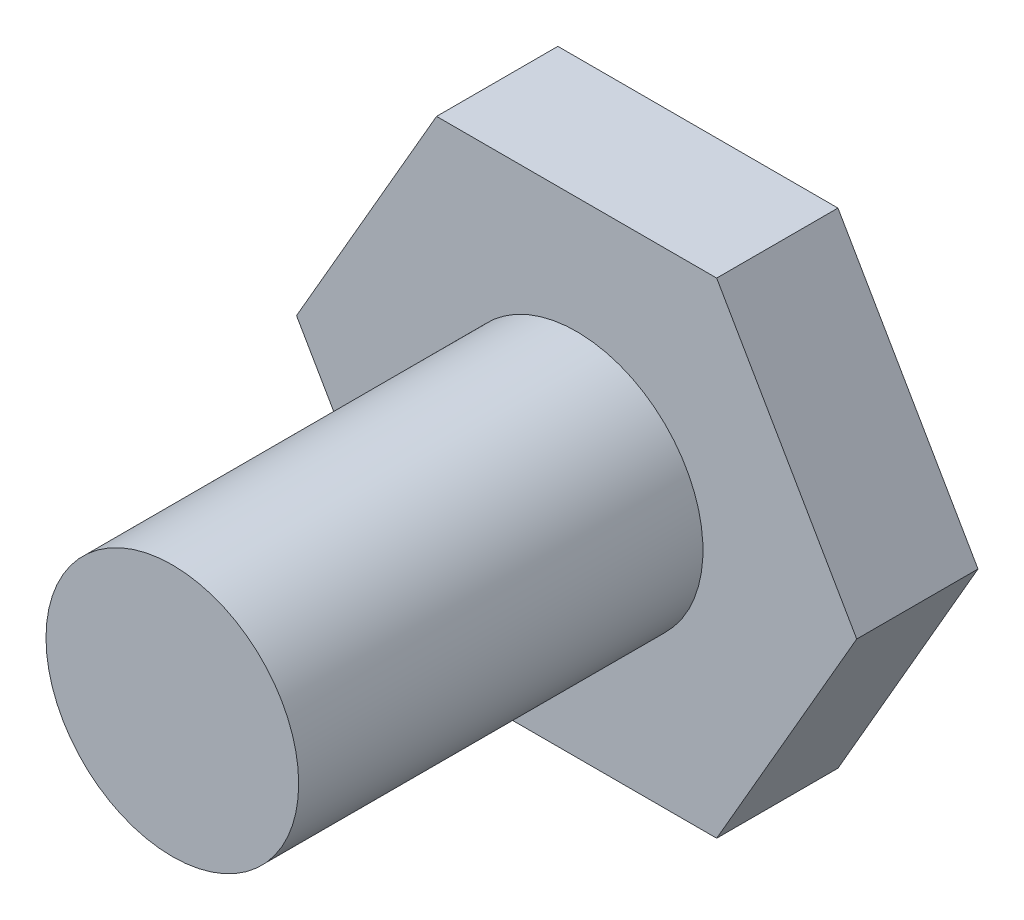
from build123d import *

# Parameters (mm, degrees)
SKETCH1_R           = 31.25
BOSS_EXTRUDE1_DEPTH = 100
BOSS_EXTRUDE2_DEPTH = 30
SKETCH3_W           = 28.564064606
SKETCH3_H           = 90
CUT_EXTRUDE1_DEPTH  = 20


with BuildPart() as part:
    # Sketch1 → Boss-Extrude1 (new body)
    with BuildSketch(Plane.XY):
        Circle(SKETCH1_R)
    extrude(amount=BOSS_EXTRUDE1_DEPTH)

    # Sketch2 → Boss-Extrude2 (add)
    with BuildSketch(Plane(origin=(0, 0, 0), x_dir=(-1, 0, 0), z_dir=(0, 0, -1))):
        Polygon((69.282032303, 0), (34.641016151, 60), (-34.641016151, 60), (-69.282032303, 0), (-34.641016151, -60), (34.641016151, -60), align=None)
    extrude(amount=BOSS_EXTRUDE2_DEPTH)

    # Sketch3 → Cut-Extrude1 (cut)
    with BuildSketch(Plane(origin=(0, 0, -30), x_dir=(-1, 0, 0), z_dir=(0, 0, -1))):
        Rectangle(SKETCH3_W, SKETCH3_H)
    extrude(amount=-CUT_EXTRUDE1_DEPTH, mode=Mode.SUBTRACT)


solid = part.part
